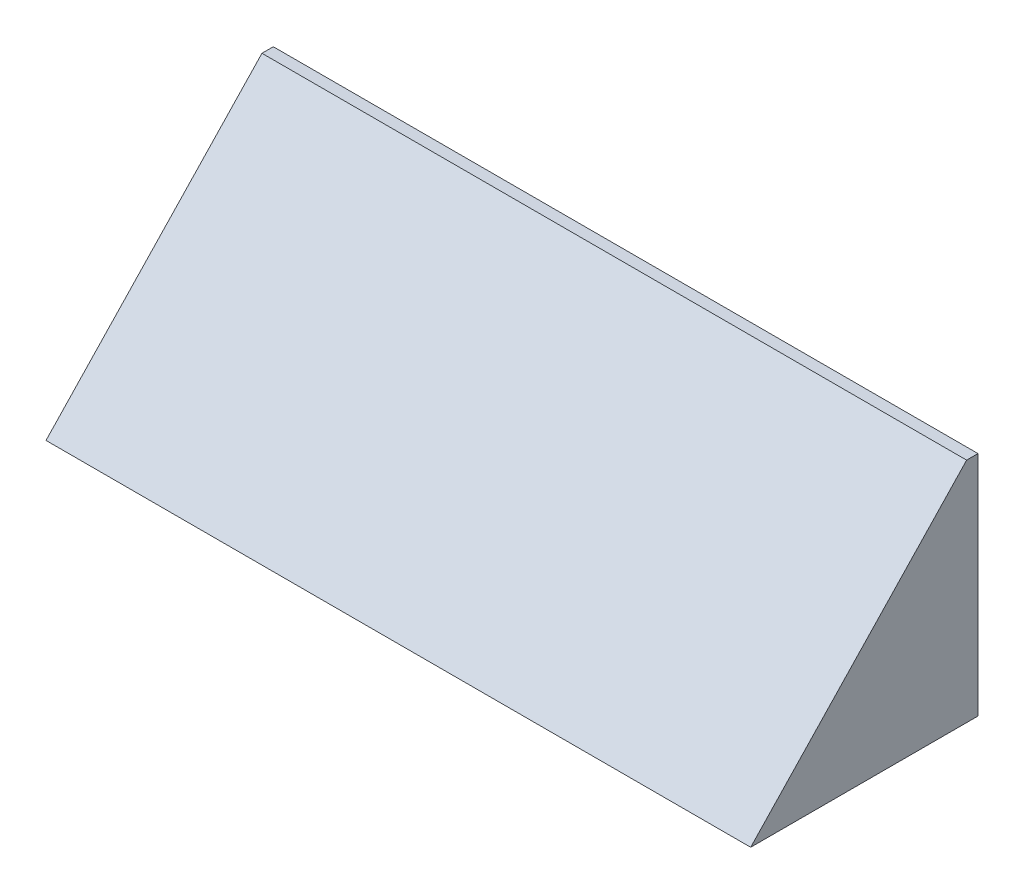
from build123d import *

# Parameters (mm, degrees)
SHELL1_T = -1


with BuildPart() as part:
    # Sketch1 → Loft2 section 0
    with BuildSketch(Plane(origin=(0, 0, 0), x_dir=(1, 0, 0), z_dir=(0, 1, 0))):
        with BuildLine():
            Line((-31.199529688, 24.851146384), (30.800470312, 24.851146384))
            Line((30.800470312, 24.851146384), (30.800470312, 4.851146384))
            Line((30.800470312, 4.851146384), (-31.199529688, 4.851146384))
            Line((-31.199529688, 4.851146384), (-31.199529688, 24.851146384))
        make_face()
    # Sketch2 → Loft2 section 1
    with BuildSketch(Plane(origin=(0, 20, 0), x_dir=(1, 0, 0), z_dir=(0, 1, 0))):
        with BuildLine():
            Line((-31.199529688, 24.851146384), (30.800470312, 24.851146384))
            Line((30.800470312, 24.851146384), (30.800470312, 23.851146384))
            Line((30.800470312, 23.851146384), (-31.199529688, 23.851146384))
            Line((-31.199529688, 23.851146384), (-31.199529688, 24.851146384))
        make_face()
    loft()

    # Shell1
    shell1_openings = [part.faces().sort_by_distance(p)[0] for p in [
        (-0.199529688, 0, -14.851146384),
    ]]
    offset(amount=SHELL1_T, openings=shell1_openings, kind=Kind.INTERSECTION)


solid = part.part
